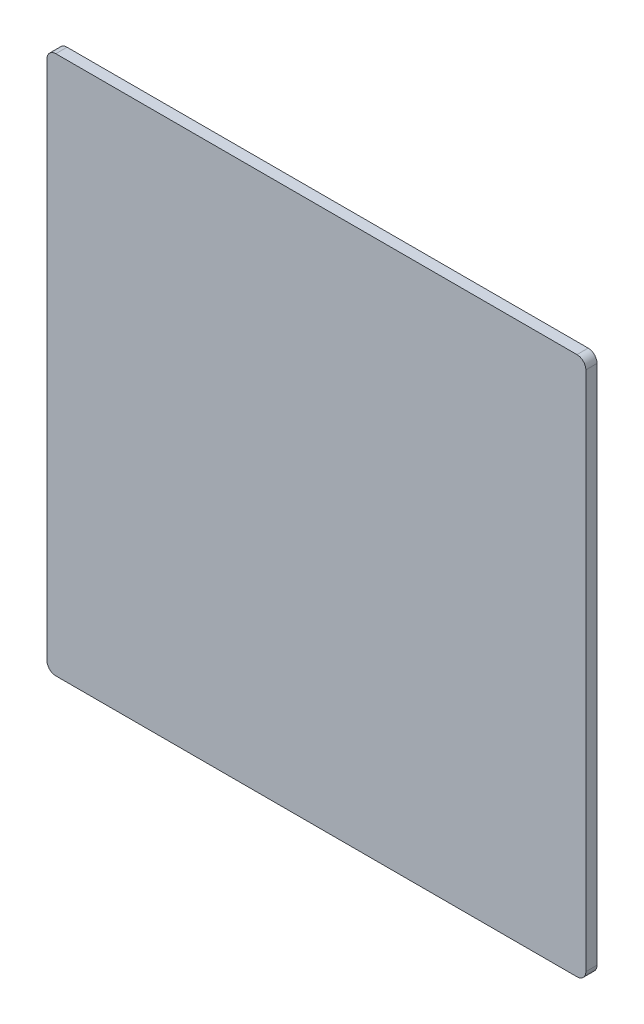
from build123d import *

# Parameters (mm, degrees)
SKETCH1_W           = 609.6
SKETCH1_H           = 609.6
BOSS_EXTRUDE1_DEPTH = 12.7
FILLET1_R           = 10


with BuildPart() as part:
    # Sketch1 → Boss-Extrude1 (new body)
    with BuildSketch(Plane.XY):
        with Locations((-133.598046875, -167.332421875)):
            Rectangle(SKETCH1_W, SKETCH1_H)
    extrude(amount=BOSS_EXTRUDE1_DEPTH)

    # Fillet1
    fillet1_edges = [part.edges().sort_by_distance(p)[0] for p in [
        (-438.398046875, 137.467578125, 6.35),
        (171.201953125, 137.467578125, 6.35),
        (171.201953125, -472.132421875, 6.35),
        (-438.398046875, -472.132421875, 6.35),
    ]]
    fillet(fillet1_edges, radius=FILLET1_R)


solid = part.part
